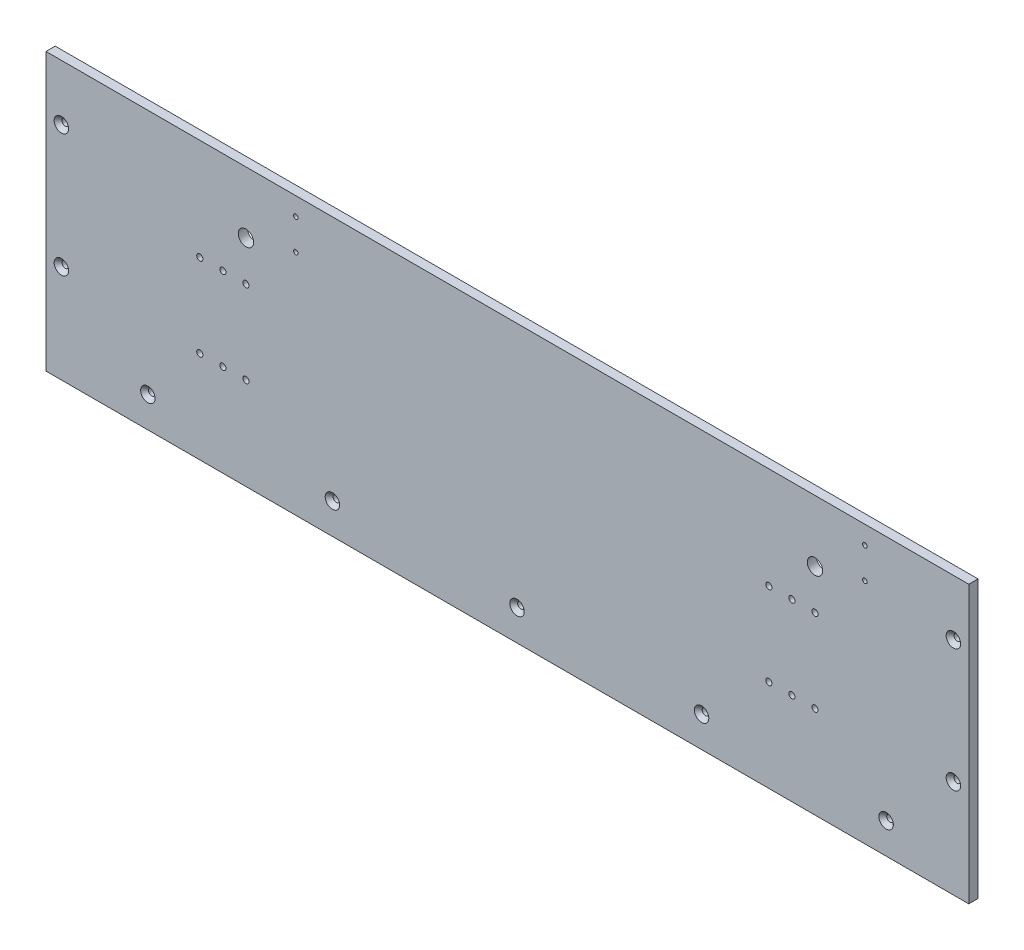
from build123d import *

# Parameters (mm, degrees)
SKETCH1_W                                       = 600
SKETCH1_H                                       = 180
BOSS_EXTRUDE1_DEPTH                             = 6
CSK_FOR_M4_FLAT_HEAD_MACHINE_SCREW1_D           = 4.3
CSK_FOR_M4_FLAT_HEAD_MACHINE_SCREW1_CSINK_D     = 9.4
CSK_FOR_M4_FLAT_HEAD_MACHINE_SCREW1_CSINK_ANGLE = 90
F_4_0MM_DOWEL_HOLE1_D                           = 4
F_3_0MM_DOWEL_HOLE1_D                           = 3
SKETCH8_R                                       = 5
CUT_EXTRUDE1_DEPTH                              = 10


with BuildPart() as part:
    # Sketch1 → Boss-Extrude1 (new body)
    with BuildSketch(Plane.XY):
        with Locations((300, 90)):
            Rectangle(SKETCH1_W, SKETCH1_H)
    extrude(amount=BOSS_EXTRUDE1_DEPTH)

    # CSK for M4 Flat Head Machine Screw1 (through all)
    with Locations(Plane.XY.offset(6)):
        with Locations((546.25, 20), (590, 63.75), (426.25, 20), (306.25, 20), (186.25, 20), (66.25, 20), (10, 63.75), (590, 143.75), (10, 143.75)):
            CounterSinkHole(CSK_FOR_M4_FLAT_HEAD_MACHINE_SCREW1_D / 2, CSK_FOR_M4_FLAT_HEAD_MACHINE_SCREW1_CSINK_D / 2, counter_sink_angle=CSK_FOR_M4_FLAT_HEAD_MACHINE_SCREW1_CSINK_ANGLE)

    # Ø4.0mm Dowel Hole1 (through all)
    with Locations(Plane.XY.offset(6)):
        with Locations((500, 60), (485, 60), (470, 60), (485, 114), (470, 114), (500, 114), (130, 114), (115, 114), (100, 114), (130, 60), (115, 60), (100, 60)):
            Hole(F_4_0MM_DOWEL_HOLE1_D / 2)

    # Ø3.0mm Dowel Hole1 (through all)
    with Locations(Plane.XY.offset(6)):
        with Locations((532.43, 148.2), (532.43, 168.2), (162.43, 148.2), (162.43, 168.2)):
            Hole(F_3_0MM_DOWEL_HOLE1_D / 2)

    # Sketch8 → Cut-Extrude1 (cut)
    with BuildSketch(Plane.XY.offset(6)):
        with Locations((500, 140)):
            Circle(SKETCH8_R)
        with Locations((130, 140)):
            Circle(SKETCH8_R)
    extrude(amount=-CUT_EXTRUDE1_DEPTH, mode=Mode.SUBTRACT)


solid = part.part
